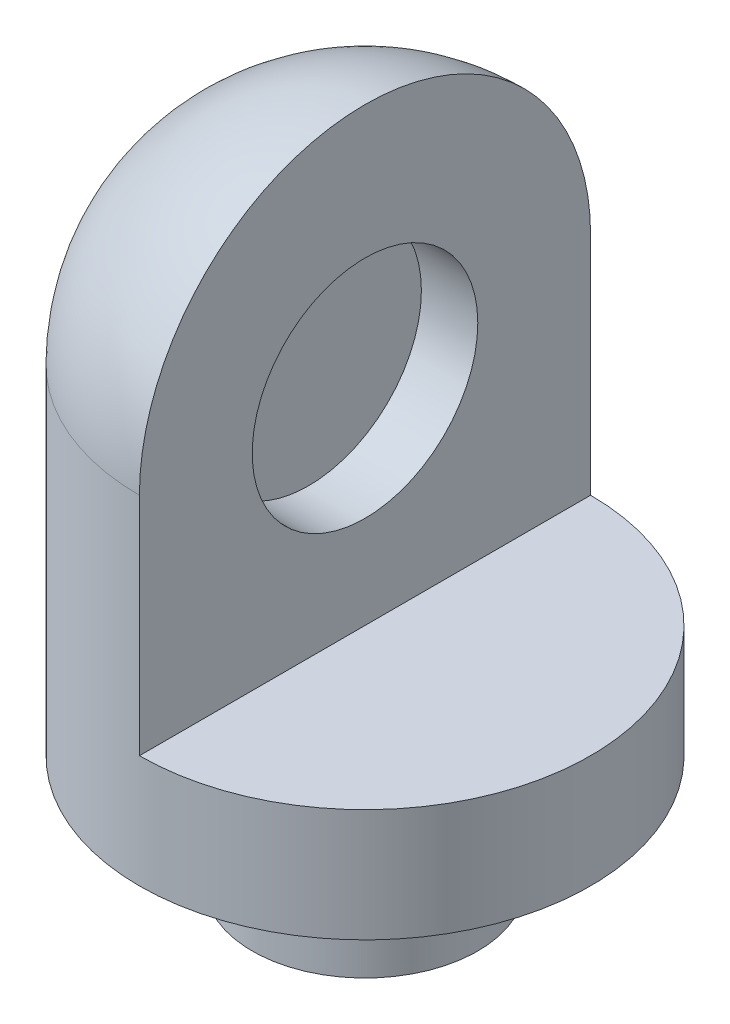
from build123d import *

# Parameters (mm, degrees)
SKETCH1_R           = 40
BOSS_EXTRUDE1_DEPTH = 100
SKETCH2_R           = 20
BOSS_EXTRUDE2_DEPTH = 20
FILLET2_R           = 40
SKETCH3_W           = 41.30426334
SKETCH3_H           = 80
CUT_EXTRUDE5_DEPTH  = 80
SKETCH5_R           = 20
CUT_EXTRUDE6_DEPTH  = 10


with BuildPart() as part:
    # Sketch1 → Boss-Extrude1 (new body)
    with BuildSketch(Plane(origin=(0, 0, 0), x_dir=(1, 0, 0), z_dir=(0, 1, 0))):
        with Locations(Location((0, 0, 0), (0, 0, 270))):
            Circle(SKETCH1_R)
    extrude(amount=BOSS_EXTRUDE1_DEPTH)

    # Sketch2 → Boss-Extrude2 (add)
    with BuildSketch(Plane.XZ):
        with Locations(Location((0, 0, 0), (0, 0, 270))):
            Circle(SKETCH2_R)
    extrude(amount=BOSS_EXTRUDE2_DEPTH)

    # Fillet2
    fillet2_edges = [part.edges().sort_by_distance(p)[0] for p in [
        (0, 100, -40),
    ]]
    fillet(fillet2_edges, radius=FILLET2_R)

    # Sketch3 → Cut-Extrude5 (cut)
    with BuildSketch(Plane(origin=(0, 100, 0), x_dir=(1, 0, 0), z_dir=(0, 1, 0))):
        with Locations((20.65213167, 0)):
            Rectangle(SKETCH3_W, SKETCH3_H)
    extrude(amount=-CUT_EXTRUDE5_DEPTH, mode=Mode.SUBTRACT)

    # Sketch5 → Cut-Extrude6 (cut)
    with BuildSketch(Plane(origin=(0, 0, 0), x_dir=(0, 0, -1), z_dir=(1, 0, 0))):
        with Locations((0, 56.442620776)):
            Circle(SKETCH5_R)
    extrude(amount=-CUT_EXTRUDE6_DEPTH, mode=Mode.SUBTRACT)


solid = part.part
